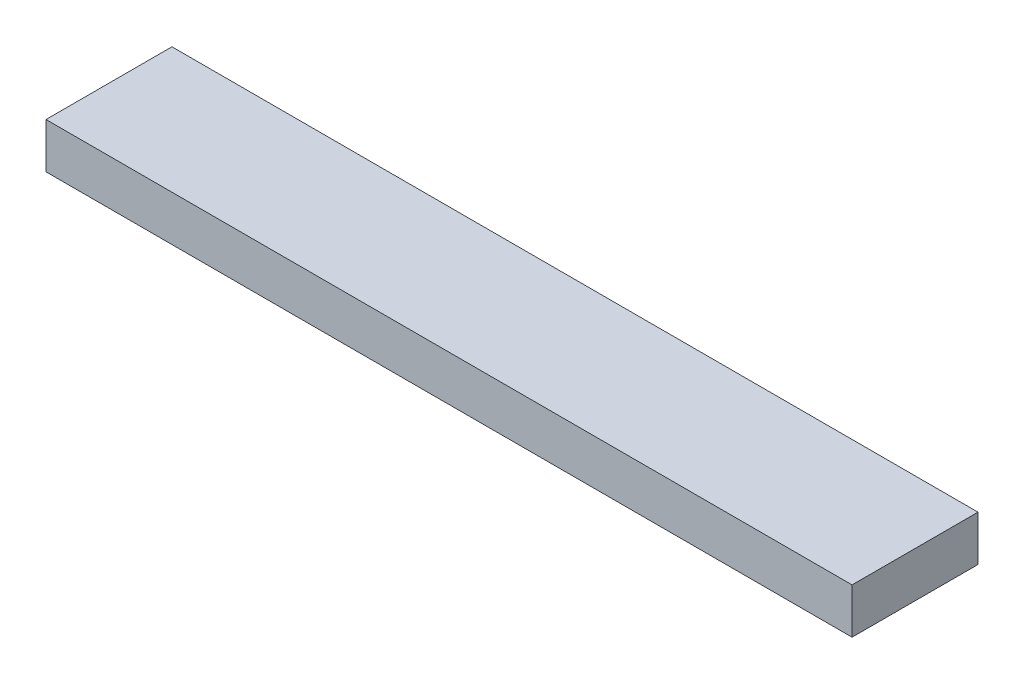
from build123d import *

# Parameters (mm, degrees)
SKETCH1_W           = 80
SKETCH1_H           = 12.5
BOSS_EXTRUDE2_DEPTH = 4.5


with BuildPart() as part:
    # Sketch1 → Boss-Extrude2 (new body)
    with BuildSketch(Plane(origin=(0, 0, 0), x_dir=(1, 0, 0), z_dir=(0, 1, 0))):
        Rectangle(SKETCH1_W, SKETCH1_H)
    extrude(amount=BOSS_EXTRUDE2_DEPTH)


solid = part.part
